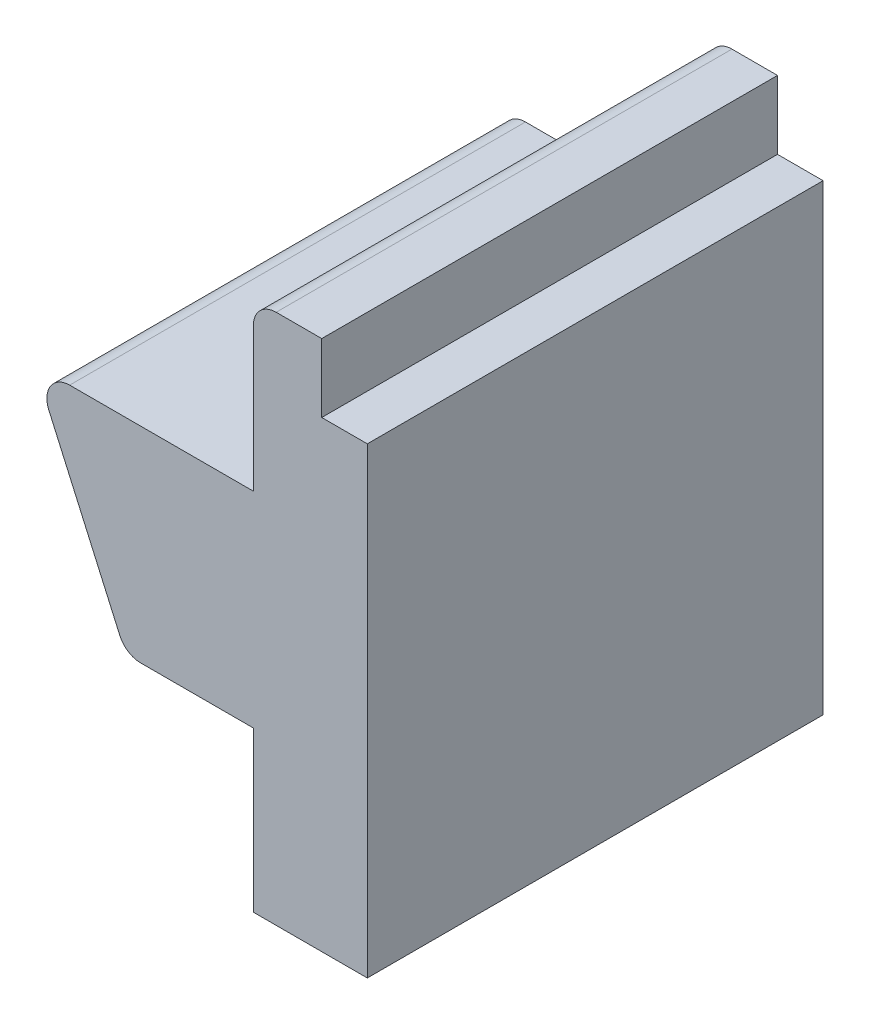
from build123d import *

# Parameters (mm, degrees)
BOSS_EXTRU_1_DEPTH      = 20
CONG_1_R                = 1
ESQUISSE3_R             = 2
ENL_V_MAT_EXTRU_1_DEPTH = 5


with BuildPart() as part:
    # Esquisse1 → Boss.-Extru.1 (new body)
    with BuildSketch(Plane.XY):
        Polygon((-2, 23.3), (-5, 23.3), (-5, 16), (-14.6, 16), (-10.6, 7), (-5, 7), (-5, 0), (0, 0), (0, 20.3), (-2, 20.3), align=None)
    extrude(amount=BOSS_EXTRU_1_DEPTH)

    # Congé1
    cong_1_edges = [part.edges().sort_by_distance(p)[0] for p in [
        (-10.6, 7, 10),
        (-14.6, 16, 10),
        (-5, 23.3, 10),
    ]]
    fillet(cong_1_edges, radius=CONG_1_R)

    # Esquisse3 → Enlèv. mat.-Extru.1 (cut)
    with BuildSketch(Plane.XZ):
        with Locations(Location((-2.5, 4, 0), (0, 0, 270))):
            Circle(ESQUISSE3_R)
        with Locations(Location((-2.5, 16, 0), (0, 0, 270))):
            Circle(ESQUISSE3_R)
    extrude(amount=-ENL_V_MAT_EXTRU_1_DEPTH, mode=Mode.SUBTRACT)


solid = part.part
